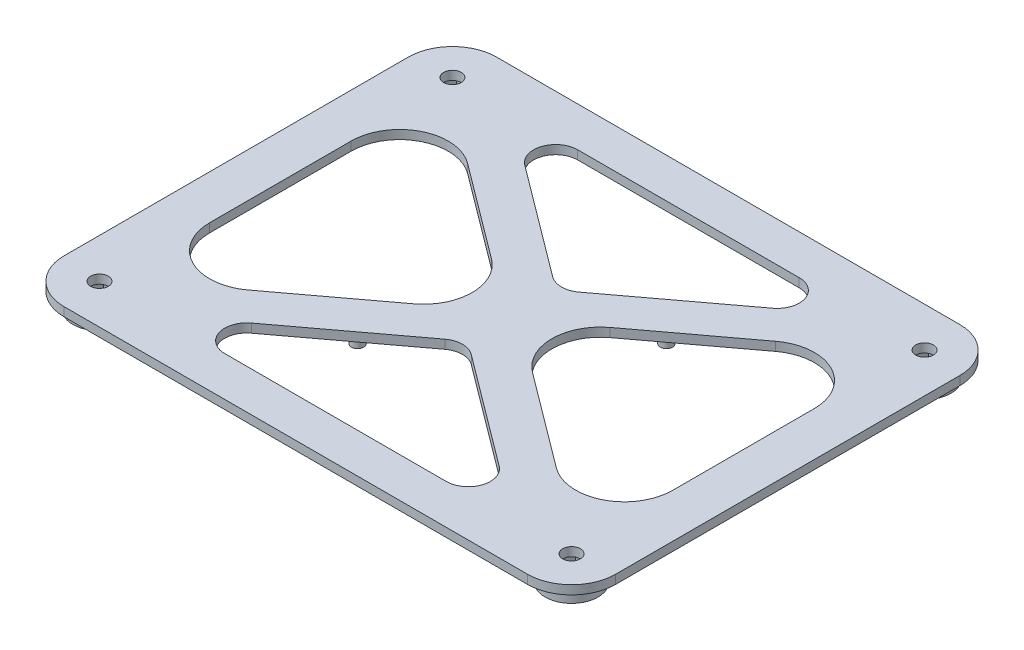
from build123d import *

# Parameters (mm, degrees)
SKETCH1_R           = 6
SKETCH1_R_2         = 2
BOSS_EXTRUDE1_DEPTH = 2
SKETCH1_3_R         = 6
BOSS_EXTRUDE2_DEPTH = 3.5
CUT_EXTRUDE2_DEPTH  = 10
SKETCH2_R           = 1.4
BOSS_EXTRUDE4_DEPTH = 3.5
FILLET3_R           = 1


with BuildPart() as part:
    # Sketch1 → Boss-Extrude1 (new body)
    # profile 1 of 9: a face of its own
    with BuildSketch(Plane(origin=(0, 0, 0), x_dir=(1, 0, 0), z_dir=(0, 1, 0))):
        with BuildLine():
            ThreePointArc((-62.5, 39), (-59.571067812, 46.071067812), (-52.5, 49))
            Line((-52.5, 49), (52.5, 49))
            ThreePointArc((52.5, 49), (59.571067812, 46.071067812), (62.5, 39))
            Line((62.5, 39), (62.5, -39))
            ThreePointArc((62.5, -39), (59.571067812, -46.071067812), (52.5, -49))
            Line((52.5, -49), (-52.5, -49))
            ThreePointArc((-52.5, -49), (-59.571067812, -46.071067812), (-62.5, -39))
            Line((-62.5, -39), (-62.5, 39))
        make_face()
        with Locations((-53.5, -40)):
            Circle(SKETCH1_R, mode=Mode.SUBTRACT)
        with Locations((53.5, -40)):
            Circle(SKETCH1_R, mode=Mode.SUBTRACT)
        with Locations((-53.5, 40)):
            Circle(SKETCH1_R, mode=Mode.SUBTRACT)
        with Locations((53.5, 40)):
            Circle(SKETCH1_R, mode=Mode.SUBTRACT)
    # profile 2 of 9: a face of its own
    with BuildSketch(Plane(origin=(0, 0, 0), x_dir=(1, 0, 0), z_dir=(0, 1, 0))):
        with Locations((53.5, 40)):
            Circle(SKETCH1_R)
        Polygon((56.197823457, 36.398368621), (57.968015998, 40.535567959), (55.270192541, 44.137199339), (50.802176543, 43.601631379), (49.031984002, 39.464432041), (51.729807459, 35.862800661), align=None, mode=Mode.SUBTRACT)
    # profile 3 of 9: a face of its own
    with BuildSketch(Plane(origin=(0, 0, 0), x_dir=(1, 0, 0), z_dir=(0, 1, 0))):
        Polygon((51.729807459, 35.862800661), (56.197823457, 36.398368621), (57.968015998, 40.535567959), (55.270192541, 44.137199339), (50.802176543, 43.601631379), (49.031984002, 39.464432041), align=None)
        with Locations((53.5, 40)):
            Circle(SKETCH1_R_2, mode=Mode.SUBTRACT)
    # profile 4 of 9: a face of its own
    with BuildSketch(Plane(origin=(0, 0, 0), x_dir=(1, 0, 0), z_dir=(0, 1, 0))):
        with Locations((53.5, -40)):
            Circle(SKETCH1_R)
        Polygon((56.197823457, -43.601631379), (57.968015998, -39.464432041), (55.270192541, -35.862800661), (50.802176543, -36.398368621), (49.031984002, -40.535567959), (51.729807459, -44.137199339), align=None, mode=Mode.SUBTRACT)
    # profile 5 of 9: a face of its own
    with BuildSketch(Plane(origin=(0, 0, 0), x_dir=(1, 0, 0), z_dir=(0, 1, 0))):
        Polygon((51.729807459, -44.137199339), (56.197823457, -43.601631379), (57.968015998, -39.464432041), (55.270192541, -35.862800661), (50.802176543, -36.398368621), (49.031984002, -40.535567959), align=None)
        with Locations((53.5, -40)):
            Circle(SKETCH1_R_2, mode=Mode.SUBTRACT)
    # profile 6 of 9: a face of its own
    with BuildSketch(Plane(origin=(0, 0, 0), x_dir=(1, 0, 0), z_dir=(0, 1, 0))):
        with Locations((-53.5, -40)):
            Circle(SKETCH1_R)
        Polygon((-50.802176543, -43.601631379), (-49.031984002, -39.464432041), (-51.729807459, -35.862800661), (-56.197823457, -36.398368621), (-57.968015998, -40.535567959), (-55.270192541, -44.137199339), align=None, mode=Mode.SUBTRACT)
    # profile 7 of 9: a face of its own
    with BuildSketch(Plane(origin=(0, 0, 0), x_dir=(1, 0, 0), z_dir=(0, 1, 0))):
        Polygon((-55.270192541, -44.137199339), (-50.802176543, -43.601631379), (-49.031984002, -39.464432041), (-51.729807459, -35.862800661), (-56.197823457, -36.398368621), (-57.968015998, -40.535567959), align=None)
        with Locations((-53.5, -40)):
            Circle(SKETCH1_R_2, mode=Mode.SUBTRACT)
    # profile 8 of 9: a face of its own
    with BuildSketch(Plane(origin=(0, 0, 0), x_dir=(1, 0, 0), z_dir=(0, 1, 0))):
        with Locations((-53.5, 40)):
            Circle(SKETCH1_R)
        Polygon((-50.802176543, 36.398368621), (-49.031984002, 40.535567959), (-51.729807459, 44.137199339), (-56.197823457, 43.601631379), (-57.968015998, 39.464432041), (-55.270192541, 35.862800661), align=None, mode=Mode.SUBTRACT)
    # profile 9 of 9: a face of its own
    with BuildSketch(Plane(origin=(0, 0, 0), x_dir=(1, 0, 0), z_dir=(0, 1, 0))):
        Polygon((-55.270192541, 35.862800661), (-50.802176543, 36.398368621), (-49.031984002, 40.535567959), (-51.729807459, 44.137199339), (-56.197823457, 43.601631379), (-57.968015998, 39.464432041), align=None)
        with Locations((-53.5, 40)):
            Circle(SKETCH1_R_2, mode=Mode.SUBTRACT)
    extrude(amount=BOSS_EXTRUDE1_DEPTH)

    # Sketch1<3> → Boss-Extrude2 (add)
    # profile 1 of 4: a face of its own
    with BuildSketch(Plane(origin=(0, 0, 0), x_dir=(1, 0, 0), z_dir=(0, 1, 0))):
        with Locations((-53.5, 40)):
            Circle(SKETCH1_3_R)
        Polygon((-50.802176543, 36.398368621), (-49.031984002, 40.535567959), (-51.729807459, 44.137199339), (-56.197823457, 43.601631379), (-57.968015998, 39.464432041), (-55.270192541, 35.862800661), align=None, mode=Mode.SUBTRACT)
    # profile 2 of 4: a face of its own
    with BuildSketch(Plane(origin=(0, 0, 0), x_dir=(1, 0, 0), z_dir=(0, 1, 0))):
        with Locations((53.5, 40)):
            Circle(SKETCH1_3_R)
        Polygon((56.197823457, 36.398368621), (57.968015998, 40.535567959), (55.270192541, 44.137199339), (50.802176543, 43.601631379), (49.031984002, 39.464432041), (51.729807459, 35.862800661), align=None, mode=Mode.SUBTRACT)
    # profile 3 of 4: a face of its own
    with BuildSketch(Plane(origin=(0, 0, 0), x_dir=(1, 0, 0), z_dir=(0, 1, 0))):
        with Locations((53.5, -40)):
            Circle(SKETCH1_3_R)
        Polygon((56.197823457, -43.601631379), (57.968015998, -39.464432041), (55.270192541, -35.862800661), (50.802176543, -36.398368621), (49.031984002, -40.535567959), (51.729807459, -44.137199339), align=None, mode=Mode.SUBTRACT)
    # profile 4 of 4: a face of its own
    with BuildSketch(Plane(origin=(0, 0, 0), x_dir=(1, 0, 0), z_dir=(0, 1, 0))):
        with Locations((-53.5, -40)):
            Circle(SKETCH1_3_R)
        Polygon((-50.802176543, -43.601631379), (-49.031984002, -39.464432041), (-51.729807459, -35.862800661), (-56.197823457, -36.398368621), (-57.968015998, -40.535567959), (-55.270192541, -44.137199339), align=None, mode=Mode.SUBTRACT)
    extrude(amount=-BOSS_EXTRUDE2_DEPTH)

    # Sketch2<4> → Cut-Extrude2 (cut)
    with BuildSketch(Plane(origin=(0, 0, 0), x_dir=(1, 0, 0), z_dir=(0, 1, 0))):
        with BuildLine():
            ThreePointArc((13.453203488, 8.809870368), (9.040022455, 0), (13.453203488, -8.809870368))
            Line((13.453203488, -8.809870368), (34.913181033, -24.854713392))
            ThreePointArc((34.913181033, -24.854713392), (46.426712462, -25.879857224), (52.5, -16.044843024))
            Line((52.5, -16.044843024), (52.5, 16.044843024))
            ThreePointArc((52.5, 16.044843024), (46.426712462, 25.879857224), (34.913181033, 24.854713392))
            Line((34.913181033, 24.854713392), (13.453203488, 8.809870368))
        make_face()
        with BuildLine():
            ThreePointArc((-13.453203488, -8.809870368), (-9.040022455, 0), (-13.453203488, 8.809870368))
            Line((-13.453203488, 8.809870368), (-34.913181033, 24.854713392))
            ThreePointArc((-34.913181033, 24.854713392), (-46.426712462, 25.879857224), (-52.5, 16.044843024))
            Line((-52.5, 16.044843024), (-52.5, -16.044843024))
            ThreePointArc((-52.5, -16.044843024), (-46.426712462, -25.879857224), (-34.913181033, -24.854713392))
            Line((-34.913181033, -24.854713392), (-13.453203488, -8.809870368))
        make_face()
        with BuildLine():
            Line((-28.096484295, 30.995513469), (-2.994008621, 12.227307358))
            ThreePointArc((-2.994008621, 12.227307358), (0, 11.231793889), (2.994008621, 12.227307358))
            Line((2.994008621, 12.227307358), (28.096484295, 30.995513469))
            ThreePointArc((28.096484295, 30.995513469), (29.847074321, 36.577587929), (25.102475674, 40))
            Line((25.102475674, 40), (-25.102475674, 40))
            ThreePointArc((-25.102475674, 40), (-29.847074321, 36.577587929), (-28.096484295, 30.995513469))
        make_face()
        with BuildLine():
            Line((28.096484295, -30.995513469), (2.994008621, -12.227307358))
            ThreePointArc((2.994008621, -12.227307358), (0, -11.231793889), (-2.994008621, -12.227307358))
            Line((-2.994008621, -12.227307358), (-28.096484295, -30.995513469))
            ThreePointArc((-28.096484295, -30.995513469), (-29.847074321, -36.577587929), (-25.102475674, -40))
            Line((-25.102475674, -40), (25.102475674, -40))
            ThreePointArc((25.102475674, -40), (29.847074321, -36.577587929), (28.096484295, -30.995513469))
        make_face()
    extrude(amount=CUT_EXTRUDE2_DEPTH, mode=Mode.SUBTRACT)

    # Sketch2 → Boss-Extrude4 (add)
    with BuildSketch(Plane(origin=(0, 0, 0), x_dir=(1, 0, 0), z_dir=(0, 1, 0))):
        with Locations((17.5, 17.5)):
            Circle(SKETCH2_R)
        with Locations((17.5, -17.5)):
            Circle(SKETCH2_R)
        with Locations((-17.5, -17.5)):
            Circle(SKETCH2_R)
        with Locations((-17.5, 17.5)):
            Circle(SKETCH2_R)
    extrude(amount=-BOSS_EXTRUDE4_DEPTH)

    # Fillet3
    fillet3_edges = [part.edges().sort_by_distance(p)[0] for p in [
        (16.1, 0, -17.5),
        (16.1, 0, 17.5),
        (-18.9, 0, 17.5),
        (-18.9, 0, -17.5),
    ]]
    fillet(fillet3_edges, radius=FILLET3_R)


solid = part.part
